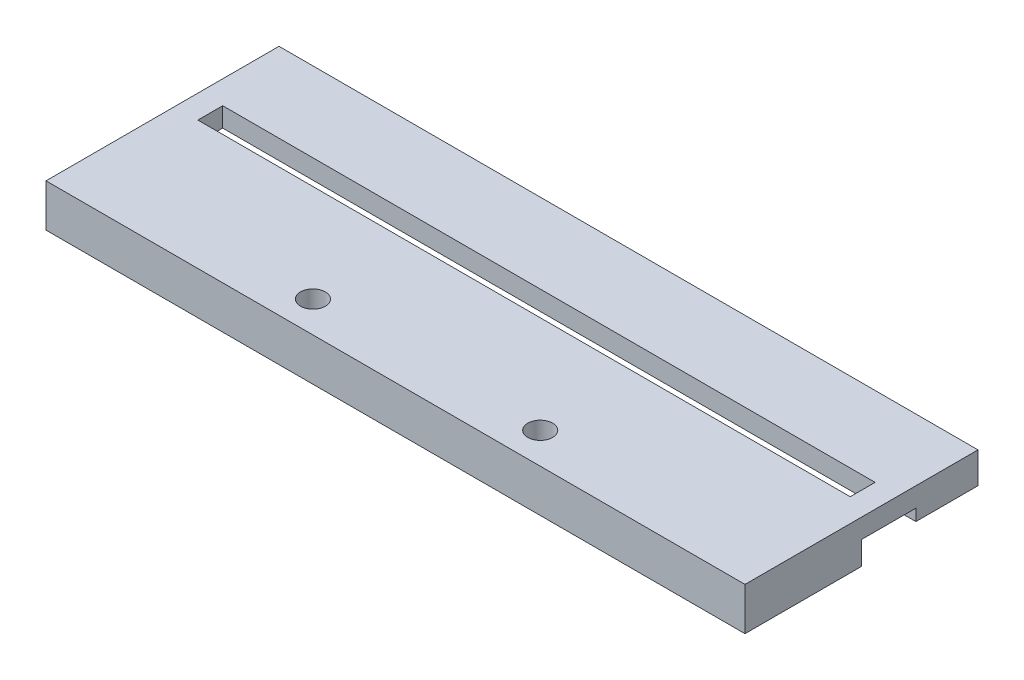
from build123d import *

# Parameters (mm, degrees)
SKETCH2_W           = 90
SKETCH2_H           = 30
BOSS_EXTRUDE1_DEPTH = 5.5
SKETCH3_W           = 90
SKETCH3_H           = 3
CUT_EXTRUDE1_DEPTH  = 1.5
SKETCH4_W           = 85
SKETCH4_H           = 1.5
CUT_EXTRUDE2_DEPTH  = 15
SKETCH5_W           = 84
SKETCH5_H           = 3.2
CUT_EXTRUDE3_DEPTH  = 2.5
SKETCH6_R           = 1.6
CUT_EXTRUDE4_DEPTH  = 48.75196331
SKETCH7_W           = 90
SKETCH7_H           = 1.5
CUT_EXTRUDE5_DEPTH  = 5
SKETCH8_W           = 90
SKETCH8_H           = 7
CUT_EXTRUDE6_DEPTH  = 3


with BuildPart() as part:
    # Sketch2 → Boss-Extrude1 (new body)
    with BuildSketch(Plane(origin=(0, 0, 0), x_dir=(1, 0, 0), z_dir=(0, 1, 0))):
        Rectangle(SKETCH2_W, SKETCH2_H)
    extrude(amount=BOSS_EXTRUDE1_DEPTH)

    # Sketch3 → Cut-Extrude1 (cut)
    with BuildSketch(Plane.XZ):
        with Locations((0, -8.5)):
            Rectangle(SKETCH3_W, SKETCH3_H)
    extrude(amount=-CUT_EXTRUDE1_DEPTH, mode=Mode.SUBTRACT)

    # Sketch4 → Cut-Extrude2 (cut)
    with BuildSketch(Plane(origin=(0, 0, -15), x_dir=(-1, 0, 0), z_dir=(0, 0, -1))):
        with Locations((0, 2.25)):
            Rectangle(SKETCH4_W, SKETCH4_H)
    extrude(amount=-CUT_EXTRUDE2_DEPTH, mode=Mode.SUBTRACT)

    # Sketch5 → Cut-Extrude3 (cut)
    with BuildSketch(Plane(origin=(0, 5.5, 0), x_dir=(1, 0, 0), z_dir=(0, 1, 0))):
        with Locations((0, 3.15)):
            Rectangle(SKETCH5_W, SKETCH5_H)
    extrude(amount=-CUT_EXTRUDE3_DEPTH, mode=Mode.SUBTRACT)

    # Sketch6 → Cut-Extrude4 (cut, through all)
    with BuildSketch(Plane(origin=(0, 5.5, 0), x_dir=(1, 0, 0), z_dir=(0, 1, 0))):
        with Locations(Location((-14.633, -11, 0), (0, 0, 270))):
            Circle(SKETCH6_R)
        with Locations(Location((14.633, -11, 0), (0, 0, 270))):
            Circle(SKETCH6_R)
    extrude(amount=-CUT_EXTRUDE4_DEPTH, mode=Mode.SUBTRACT)

    # Sketch7 → Cut-Extrude5 (cut)
    with BuildSketch(Plane(origin=(0, 0, -15), x_dir=(-1, 0, 0), z_dir=(0, 0, -1))):
        with Locations((0, 0.75)):
            Rectangle(SKETCH7_W, SKETCH7_H)
    extrude(amount=-CUT_EXTRUDE5_DEPTH, mode=Mode.SUBTRACT)

    # Sketch8 → Cut-Extrude6 (cut)
    with BuildSketch(Plane(origin=(0, 0, 0), x_dir=(-1, 0, 0), z_dir=(0, -1, 0))):
        with Locations((0, 3.5)):
            Rectangle(SKETCH8_W, SKETCH8_H)
    extrude(amount=-CUT_EXTRUDE6_DEPTH, mode=Mode.SUBTRACT)


solid = part.part
